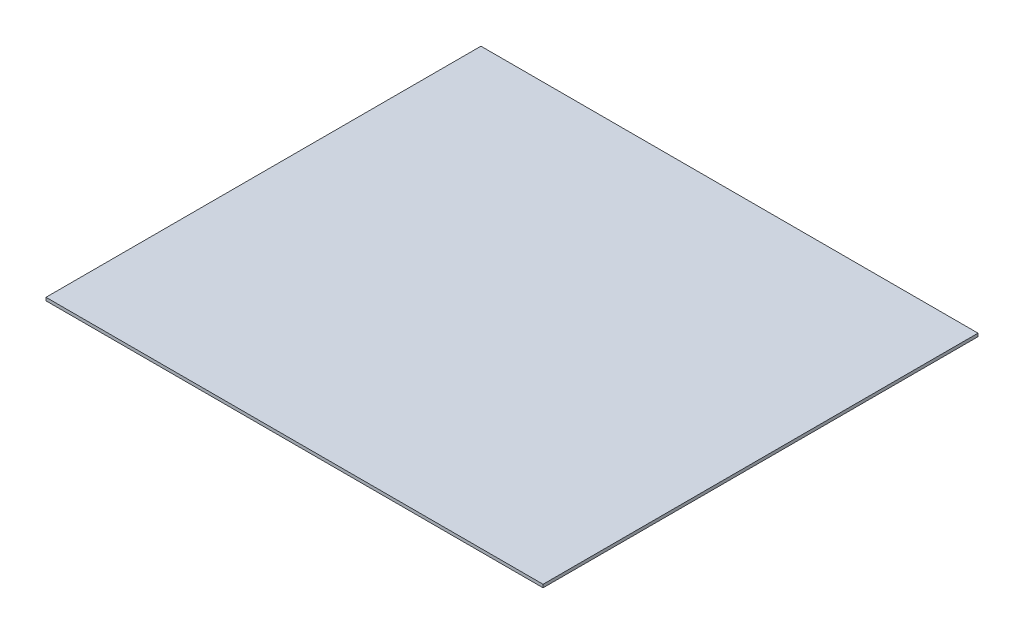
from build123d import *

# Parameters (mm, degrees)
SKETCH1_W           = 160
SKETCH1_H           = 140
BOSS_EXTRUDE1_DEPTH = 1


with BuildPart() as part:
    # Sketch1 → Boss-Extrude1 (new body)
    with BuildSketch(Plane(origin=(0, 0, 0), x_dir=(1, 0, 0), z_dir=(0, 1, 0))):
        Rectangle(SKETCH1_W, SKETCH1_H)
    extrude(amount=BOSS_EXTRUDE1_DEPTH)


solid = part.part
